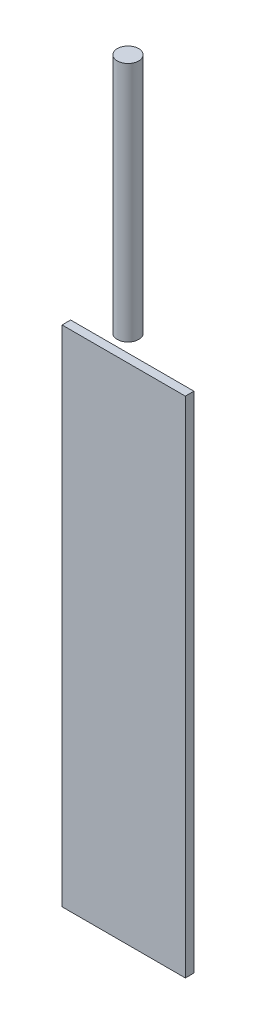
from build123d import *

# Parameters (mm, degrees)
SKETCH1_W           = 23
SKETCH1_H           = 94
BOSS_EXTRUDE1_DEPTH = 1.6
SKETCH2_R           = 2
BOSS_EXTRUDE2_DEPTH = 45


with BuildPart() as part:
    # Sketch1 → Boss-Extrude1 (new body)
    with BuildSketch(Plane.XY.offset(25.2)):
        with Locations((20, -228.5)):
            Rectangle(SKETCH1_W, SKETCH1_H)
    extrude(amount=BOSS_EXTRUDE1_DEPTH)


with BuildPart() as body_2:
    # Sketch2 → Boss-Extrude2 (new body)
    with BuildSketch(Plane(origin=(0, -177.5, 0), x_dir=(1, 0, 0), z_dir=(0, 1, 0))):
        with Locations(Location((20, -26, 0), (0, 0, 90))):
            Circle(SKETCH2_R)
    extrude(amount=BOSS_EXTRUDE2_DEPTH)


solid = Compound([part.part, body_2.part])
